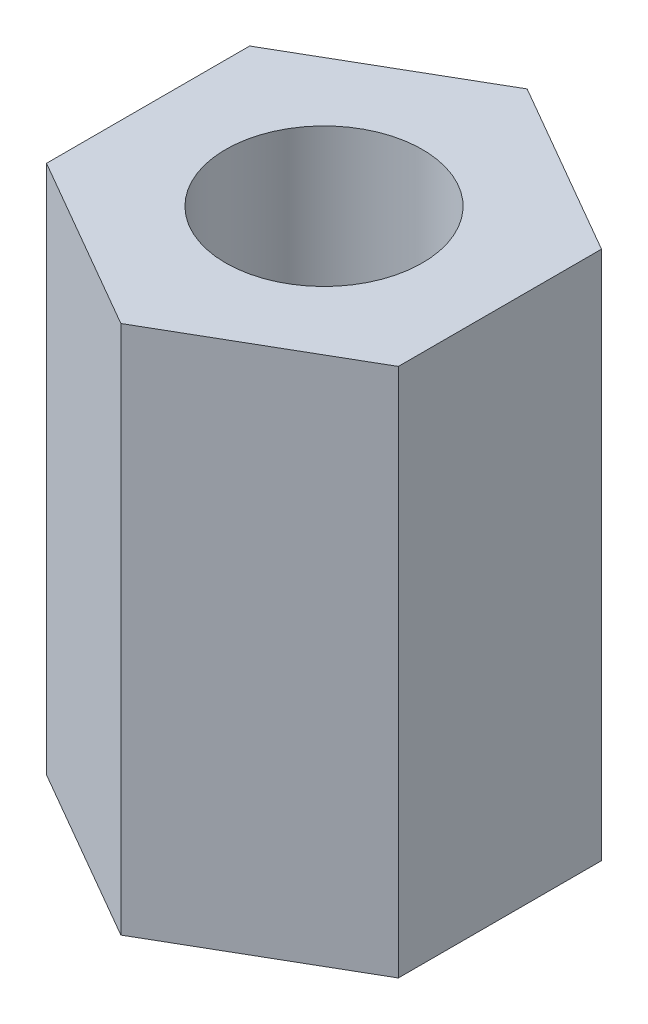
from build123d import *

# Parameters (mm, degrees)
SKETCH1_R   = 1.3
SHAPE_DEPTH = 7


with BuildPart() as part:
    # Sketch1 → Shape (new body)
    with BuildSketch(Plane(origin=(0, 0, 0), x_dir=(1, 0, 0), z_dir=(0, 1, 0))):
        Polygon((0, -2.684678752), (2.325, -1.342339376), (2.325, 1.342339376), (0, 2.684678752), (-2.325, 1.342339376), (-2.325, -1.342339376), align=None)
        with Locations(Location((0, 0, 0), (0, 0, 270))):
            Circle(SKETCH1_R, mode=Mode.SUBTRACT)
    extrude(amount=SHAPE_DEPTH)


solid = part.part
